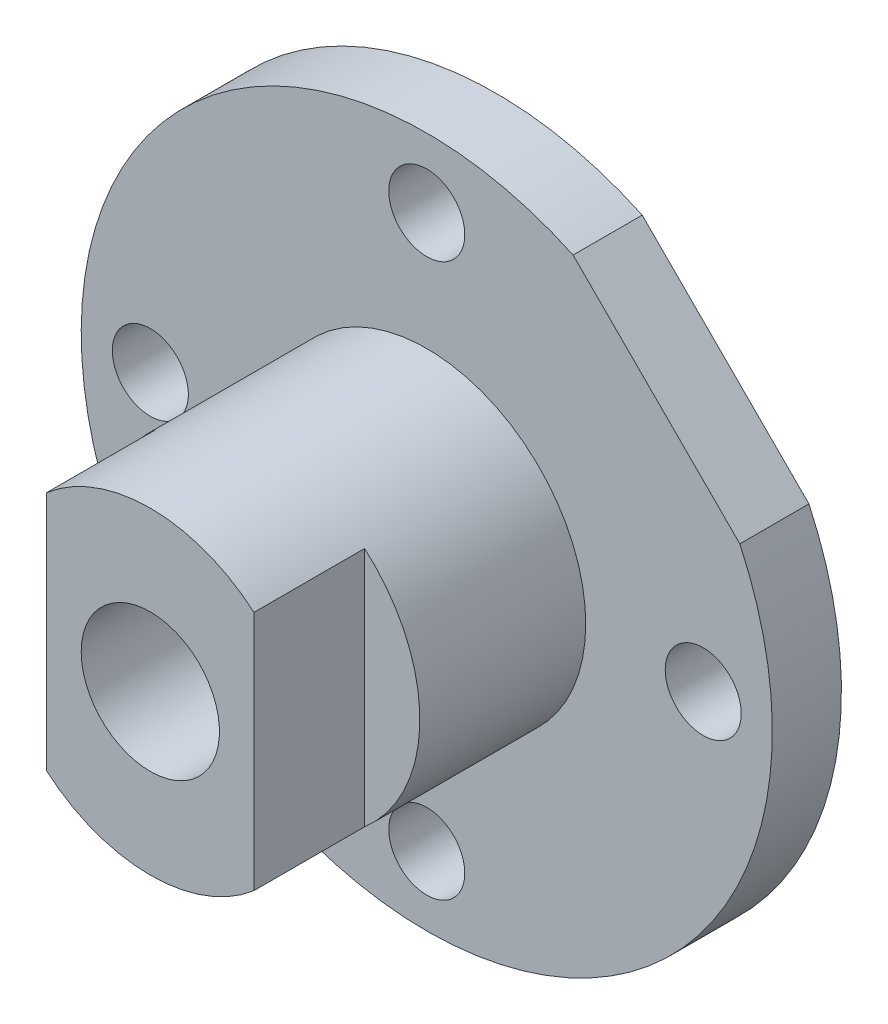
from build123d import *

# Parameters (mm, degrees)
SKETCH1_R            = 11.5
BOSS_EXTRUDE1_DEPTH  = 25
SKETCH2_R            = 25
BOSS_EXTRUDE2_DEPTH  = 5
SKETCH3_R            = 5
CUT_EXTRUDE1_DEPTH   = 44.301270189
CUT_EXTRUDE2_DEPTH   = 10
SKETCH5_W            = 4
SKETCH5_H            = 8
CUT_EXTRUDE3_DEPTH   = 44.301270189
M5_CLEARANCE_HOLE1_D = 5.5
CUT_EXTRUDE4_DEPTH   = 44.301270189


with BuildPart() as part:
    # Sketch1 → Boss-Extrude1 (new body)
    with BuildSketch(Plane.XY):
        Circle(SKETCH1_R)
    extrude(amount=BOSS_EXTRUDE1_DEPTH)

    # Sketch2 → Boss-Extrude2 (add)
    with BuildSketch(Plane(origin=(0, 0, 0), x_dir=(-1, 0, 0), z_dir=(0, 0, -1))):
        Circle(SKETCH2_R)
    extrude(amount=-BOSS_EXTRUDE2_DEPTH)

    # Sketch3 → Cut-Extrude1 (cut, through all)
    with BuildSketch(Plane(origin=(0, 0, 0), x_dir=(-1, 0, 0), z_dir=(0, 0, -1))):
        Circle(SKETCH3_R)
    extrude(amount=-CUT_EXTRUDE1_DEPTH, mode=Mode.SUBTRACT)

    # Sketch4 → Cut-Extrude2 (cut)
    with BuildSketch(Plane(origin=(0, 0, 0), x_dir=(-1, 0, 0), z_dir=(0, 0, -1))):
        Polygon((8, 0), (4, 6.92820323), (-4, 6.92820323), (-8, 0), (-4, -6.92820323), (4, -6.92820323), align=None)
    extrude(amount=-CUT_EXTRUDE2_DEPTH, mode=Mode.SUBTRACT)

    # Sketch5 → Cut-Extrude3 (cut, symmetric)
    with BuildSketch(Plane(origin=(0, 0, 0), x_dir=(1, 0, 0), z_dir=(0, 1, 0))):
        with Locations((9.5, -21)):
            Rectangle(SKETCH5_W, SKETCH5_H)
    cut_extrude3 = extrude(amount=CUT_EXTRUDE3_DEPTH, both=True, mode=Mode.SUBTRACT)

    # Mirror1: Cut-Extrude3 across plane
    add(cut_extrude3.mirror(Plane(origin=(0, 0, 0), x_dir=(0, 0, 1), z_dir=(1, 0, 0))), mode=Mode.SUBTRACT)

    # M5 Clearance Hole1 (through all)
    with Locations(Plane(origin=(0, 0, 0), x_dir=(-1, 0, 0), z_dir=(0, 0, -1))):
        with Locations((0, 20), (-20, 0), (20, 0), (0, -20)):
            Hole(M5_CLEARANCE_HOLE1_D / 2)

    # Sketch8 → Cut-Extrude4 (cut, through all)
    with BuildSketch(Plane(origin=(0, 0, 0), x_dir=(-1, 0, 0), z_dir=(0, 0, -1))):
        with BuildLine():
            Line((-22.648178399, 10.585840317), (-10.585840317, 22.648178399))
            ThreePointArc((-10.585840317, 22.648178399), (-17.67766953, 17.67766953), (-22.648178399, 10.585840317))
        make_face()
    extrude(amount=-CUT_EXTRUDE4_DEPTH, mode=Mode.SUBTRACT)


solid = part.part
